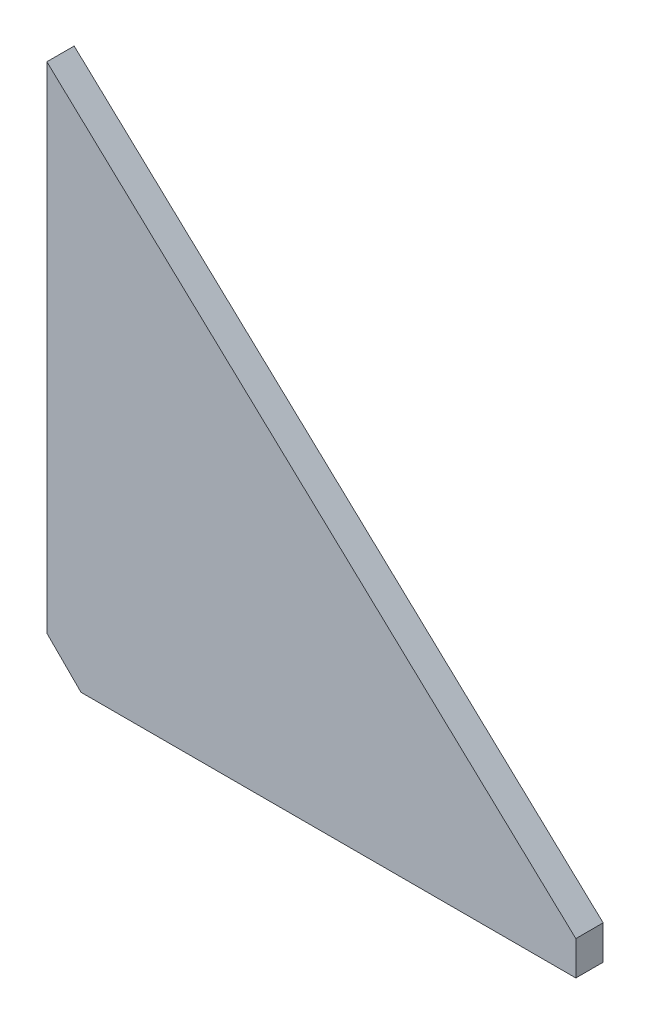
from build123d import *

# Parameters (mm, degrees)
BOSS_EXTRUDE1_DEPTH = 8


with BuildPart() as part:
    # Sketch1 → Boss-Extrude1 (new body)
    with BuildSketch(Plane.XY):
        Polygon((66.921364985, -2.989614243), (-78.078635015, -2.989614243), (-88.078635015, 7.010385757), (-88.078635015, 152.010385757), (66.921364985, 7.010385757), align=None)
    extrude(amount=BOSS_EXTRUDE1_DEPTH)


solid = part.part
